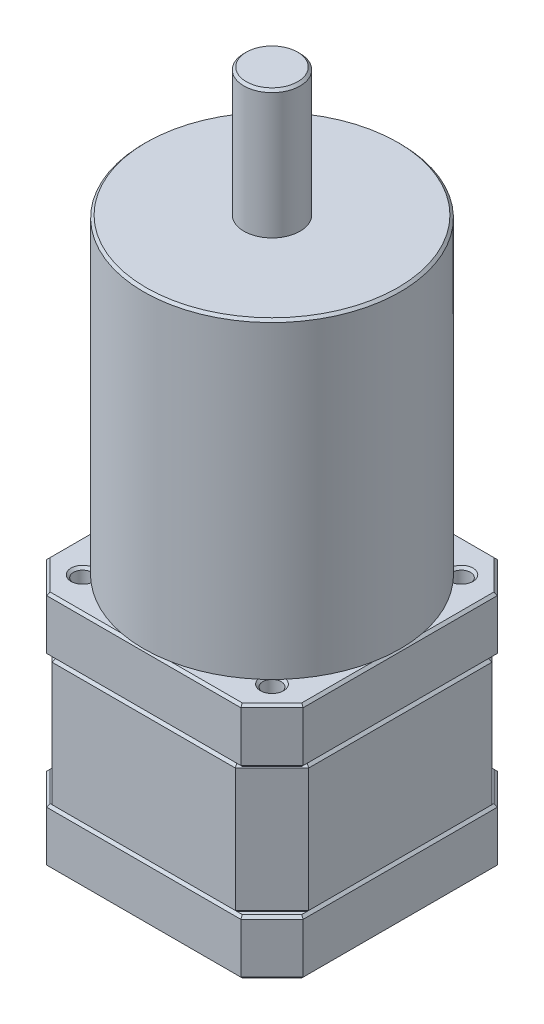
from build123d import *

# Parameters (mm, degrees)
SKETCH1_W           = 42
SKETCH1_H           = 42
BOSS_EXTRUDE1_DEPTH = 9
CHAMFER1_SIZE       = 5.1
CHAMFER2_SIZE       = 0.4
SKETCH3_W           = 42
SKETCH3_H           = 42
BOSS_EXTRUDE3_DEPTH = 21
CHAMFER3_SIZE       = 6
CHAMFER4_SIZE       = 0.4
SKETCH4_W           = 42
SKETCH4_H           = 42
BOSS_EXTRUDE4_DEPTH = 9
CHAMFER5_SIZE       = 5.1
SKETCH5_R           = 11
BOSS_EXTRUDE5_DEPTH = 2
SKETCH7_R           = 1.5
CUT_EXTRUDE1_DEPTH  = 5
CHAMFER6_SIZE       = 0.4
SKETCH6_R           = 2.5
BOSS_EXTRUDE6_DEPTH = 24
CHAMFER7_SIZE       = 0.4
SKETCH8_R           = 21
BOSS_EXTRUDE7_DEPTH = 51
SKETCH9_R           = 4.6
BOSS_EXTRUDE8_DEPTH = 21
CHAMFER8_SIZE       = 0.4
CHAMFER9_SIZE       = 0.4


with BuildPart() as part:
    # Sketch1 → Boss-Extrude1 (new body)
    with BuildSketch(Plane(origin=(0, 0, 0), x_dir=(1, 0, 0), z_dir=(0, 1, 0))):
        Rectangle(SKETCH1_W, SKETCH1_H)
    extrude(amount=BOSS_EXTRUDE1_DEPTH)

    # Chamfer1
    chamfer1_edges = [part.edges().sort_by_distance(p)[0] for p in [
        (21, 4.5, 21),
        (-21, 4.5, 21),
        (-21, 4.5, -21),
        (21, 4.5, -21),
    ]]
    chamfer(chamfer1_edges, length=CHAMFER1_SIZE)

    # Chamfer2
    chamfer2_edges = [part.edges().sort_by_distance(p)[0] for p in [
        (-21, 0, 0),
        (-21, 9, 0),
        (21, 0, 0),
        (0, 0, 21),
        (0, 0, -21),
        (-18.45, 0, 18.45),
        (18.45, 0, 18.45),
        (18.45, 0, -18.45),
        (-18.45, 0, -18.45),
        (0, 9, -21),
        (21, 9, 0),
        (0, 9, 21),
        (-18.45, 9, 18.45),
        (18.45, 9, 18.45),
        (18.45, 9, -18.45),
        (-18.45, 9, -18.45),
    ]]
    chamfer(chamfer2_edges, length=CHAMFER2_SIZE)


with BuildPart() as body_2:
    # Sketch3 → Boss-Extrude3 (new body)
    with BuildSketch(Plane(origin=(0, 9, 0), x_dir=(1, 0, 0), z_dir=(0, 1, 0))):
        Rectangle(SKETCH3_W, SKETCH3_H)
    extrude(amount=BOSS_EXTRUDE3_DEPTH)

    # Chamfer3
    chamfer3_edges = [body_2.edges().sort_by_distance(p)[0] for p in [
        (-21, 19.5, -21),
        (21, 19.5, -21),
        (21, 19.5, 21),
        (-21, 19.5, 21),
    ]]
    chamfer(chamfer3_edges, length=CHAMFER3_SIZE)

    # Chamfer4
    chamfer4_edges = [body_2.edges().sort_by_distance(p)[0] for p in [
        (-21, 9, 0),
        (-21, 30, 0),
        (0, 9, -21),
        (21, 9, 0),
        (0, 9, 21),
        (18, 9, 18),
        (-18, 9, 18),
        (18, 9, -18),
        (-18, 9, -18),
        (0, 30, -21),
        (0, 30, 21),
        (21, 30, 0),
        (18, 30, 18),
        (-18, 30, 18),
        (18, 30, -18),
        (-18, 30, -18),
    ]]
    chamfer(chamfer4_edges, length=CHAMFER4_SIZE)


with BuildPart() as body_3:
    # Sketch4 → Boss-Extrude4 (new body)
    with BuildSketch(Plane(origin=(0, 30, 0), x_dir=(1, 0, 0), z_dir=(0, 1, 0))):
        Rectangle(SKETCH4_W, SKETCH4_H)
    extrude(amount=BOSS_EXTRUDE4_DEPTH)

    # Chamfer5
    chamfer5_edges = [body_3.edges().sort_by_distance(p)[0] for p in [
        (-21, 34.5, -21),
        (21, 34.5, -21),
        (21, 34.5, 21),
        (-21, 34.5, 21),
    ]]
    chamfer(chamfer5_edges, length=CHAMFER5_SIZE)

    # Sketch5 → Boss-Extrude5 (add)
    with BuildSketch(Plane(origin=(0, 39, 0), x_dir=(1, 0, 0), z_dir=(0, 1, 0))):
        with Locations(Location((0, 0, 0), (0, 0, 270))):
            Circle(SKETCH5_R)
    extrude(amount=BOSS_EXTRUDE5_DEPTH)

    # Sketch7 → Cut-Extrude1 (cut)
    with BuildSketch(Plane(origin=(0, 39, 0), x_dir=(1, 0, 0), z_dir=(0, 1, 0))):
        with Locations(Location((15.5, -15.5, 0), (0, 0, 270))):
            Circle(SKETCH7_R)
        with Locations(Location((-15.5, -15.5, 0), (0, 0, 270))):
            Circle(SKETCH7_R)
        with Locations(Location((15.5, 15.5, 0), (0, 0, 270))):
            Circle(SKETCH7_R)
        with Locations(Location((-15.5, 15.5, 0), (0, 0, 270))):
            Circle(SKETCH7_R)
    extrude(amount=-CUT_EXTRUDE1_DEPTH, mode=Mode.SUBTRACT)

    # Chamfer6
    chamfer6_edges = [body_3.edges().sort_by_distance(p)[0] for p in [
        (21, 30, 0),
        (21, 39, 0),
        (-21, 30, 0),
        (0, 30, -21),
        (0, 30, 21),
        (18.45, 30, -18.45),
        (-18.45, 30, -18.45),
        (-18.45, 30, 18.45),
        (18.45, 30, 18.45),
        (0, 39, 21),
        (-21, 39, 0),
        (0, 39, -21),
        (18.45, 39, -18.45),
        (-18.45, 39, -18.45),
        (-18.45, 39, 18.45),
        (18.45, 39, 18.45),
        (0, 39, -11),
        (0, 41, -11),
        (-15.5, 34, 14),
        (-15.5, 39, 14),
        (15.5, 34, -17),
        (15.5, 39, -17),
        (-15.5, 34, -17),
        (-15.5, 39, -17),
        (15.5, 34, 14),
        (15.5, 39, 14),
    ]]
    chamfer(chamfer6_edges, length=CHAMFER6_SIZE)



with BuildPart() as body_4:
    # Sketch6 → Boss-Extrude6 (new body)
    with BuildSketch(Plane(origin=(0, 41, 0), x_dir=(1, 0, 0), z_dir=(0, 1, 0))):
        with Locations(Location((0, 0, 0), (0, 0, 270))):
            Circle(SKETCH6_R)
    extrude(amount=BOSS_EXTRUDE6_DEPTH)

    # Chamfer7
    chamfer7_edges = [body_4.edges().sort_by_distance(p)[0] for p in [
        (0, 65, -2.5),
    ]]
    chamfer(chamfer7_edges, length=CHAMFER7_SIZE)


with BuildPart() as body_3_1:
    add(body_3.part)

    add(body_4.part)  # Boss-Extrude7 merges body 4
    # Sketch8 → Boss-Extrude7 (add)
    with BuildSketch(Plane(origin=(0, 39, 0), x_dir=(1, 0, 0), z_dir=(0, 1, 0))):
        with Locations(Location((0, 0, 0), (0, 0, 78.79918163))):
            Circle(SKETCH8_R)
    extrude(amount=BOSS_EXTRUDE7_DEPTH)

    # Chamfer9
    chamfer9_edges = [body_3_1.edges().sort_by_distance(p)[0] for p in [
        (-4.079215611, 90, 20.6),
    ]]
    chamfer(chamfer9_edges, length=CHAMFER9_SIZE)


with BuildPart() as body_4_2:
    # Sketch9 → Boss-Extrude8 (new body)
    with BuildSketch(Plane(origin=(0, 90, 0), x_dir=(1, 0, 0), z_dir=(0, 1, 0))):
        with Locations(Location((0, 0, 0), (0, 0, 90))):
            Circle(SKETCH9_R)
    extrude(amount=BOSS_EXTRUDE8_DEPTH)

    # Chamfer8
    chamfer8_edges = [body_4_2.edges().sort_by_distance(p)[0] for p in [
        (0, 111, 4.6),
    ]]
    chamfer(chamfer8_edges, length=CHAMFER8_SIZE)


solid = Compound([part.part, body_2.part, body_3_1.part, body_4_2.part])
